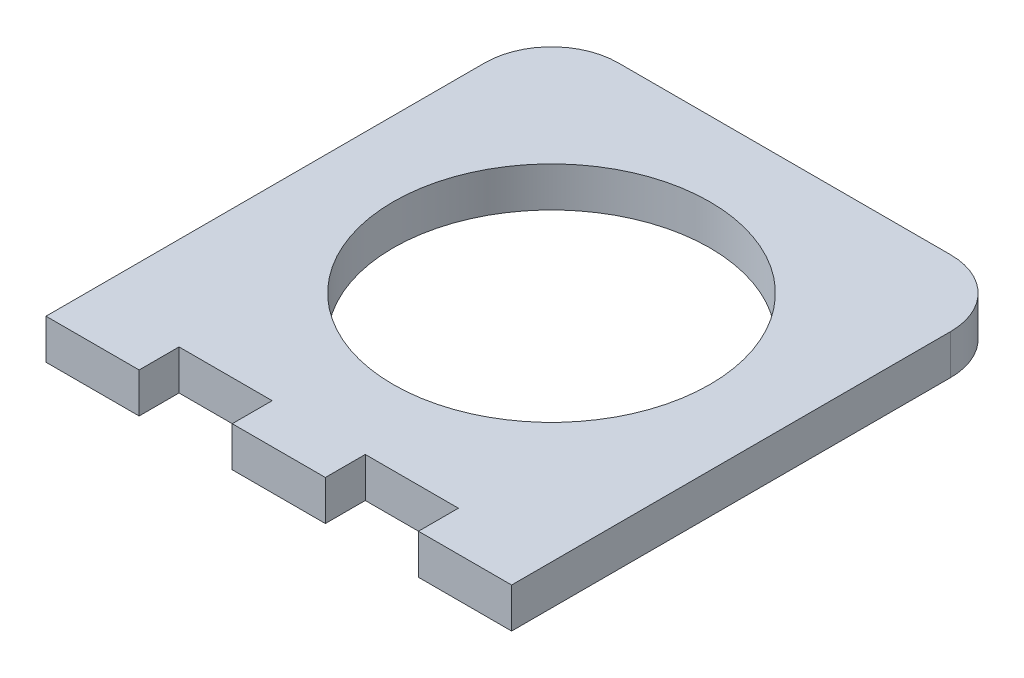
from build123d import *

# Parameters (mm, degrees)
SKETCH2_W           = 35
SKETCH2_H           = 38
BOSS_EXTRUDE1_DEPTH = 3
SKETCH3_R           = 11.9
CUT_EXTRUDE1_DEPTH  = 3
FILLET1_R           = 5
FILLET2_R           = 5
SKETCH4_W           = 7
SKETCH4_H           = 3
CUT_EXTRUDE2_DEPTH  = 3
LPATTERN1_COUNT     = 2
LPATTERN1_PITCH     = 14


with BuildPart() as part:
    # Sketch2 → Boss-Extrude1 (new body)
    with BuildSketch(Plane(origin=(0, 0, 0), x_dir=(1, 0, 0), z_dir=(0, 1, 0))):
        Rectangle(SKETCH2_W, SKETCH2_H)
    extrude(amount=BOSS_EXTRUDE1_DEPTH)

    # Sketch3 → Cut-Extrude1 (cut)
    with BuildSketch(Plane(origin=(0, 3, 0), x_dir=(1, 0, 0), z_dir=(0, 1, 0))):
        with Locations(Location((0, 1.5, 0), (0, 0, 270))):
            Circle(SKETCH3_R)
    extrude(amount=-CUT_EXTRUDE1_DEPTH, mode=Mode.SUBTRACT)

    # Fillet1
    fillet1_edges = [part.edges().sort_by_distance(p)[0] for p in [
        (17.5, 1.5, -19),
    ]]
    fillet(fillet1_edges, radius=FILLET1_R)

    # Fillet2
    fillet2_edges = [part.edges().sort_by_distance(p)[0] for p in [
        (-17.5, 1.5, -19),
    ]]
    fillet(fillet2_edges, radius=FILLET2_R)

    # Sketch4 → Cut-Extrude2 (cut)
    with BuildSketch(Plane(origin=(0, 3, 0), x_dir=(1, 0, 0), z_dir=(0, 1, 0))):
        with Locations((-7, -17.5)):
            Rectangle(SKETCH4_W, SKETCH4_H)
    cut_extrude2 = extrude(amount=-CUT_EXTRUDE2_DEPTH, mode=Mode.SUBTRACT)

    # LPattern1: Cut-Extrude2 ×2
    with Locations(*[(i * LPATTERN1_PITCH, 0, 0) for i in range(1, LPATTERN1_COUNT)]):
        add(cut_extrude2, mode=Mode.SUBTRACT)


solid = part.part
